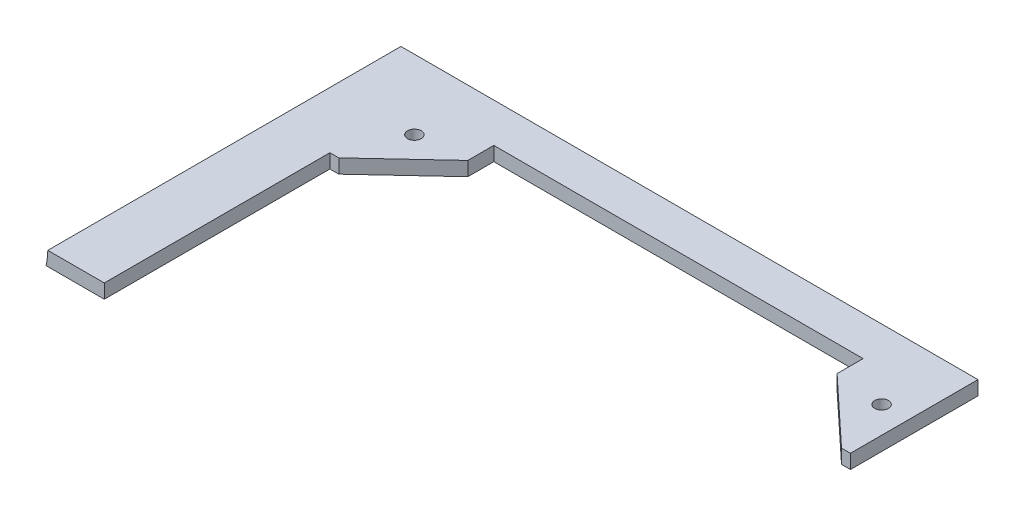
from build123d import *

# Parameters (mm, degrees)
SKETCH1_W            = 152.4
SKETCH1_H            = 76.2
BOSS_EXTRUDE1_DEPTH  = 3.175
SKETCH2_R            = 1.545336663
CUT_EXTRUDE4_DEPTH   = 86.253332046
SKETCH3_W            = 134.7
SKETCH3_H            = 3.175
BOSS_EXTRUDE2_DEPTH  = 3.175
CUT_SWEEP1_PROFILE_R = 12.7


with BuildPart() as part:
    # Sketch1 → Boss-Extrude1 (new body)
    with BuildSketch(Plane(origin=(0, 0, 0), x_dir=(1, 0, 0), z_dir=(0, 1, 0))):
        Rectangle(SKETCH1_W, SKETCH1_H)
    extrude(amount=BOSS_EXTRUDE1_DEPTH)

    # Sketch2 → Cut-Extrude4 (cut, through all)
    with BuildSketch(Plane(origin=(0, 3.175, 0), x_dir=(1, 0, 0), z_dir=(0, 1, 0))):
        Polygon((-58.5, 12.6), (-58.5, -38.1), (76.2, -38.1), (76.2, 38.1), (58.5, 38.1), (58.5, 12.6), (56.5, 12.6), (41.5, 26.6), (41.5, 32.45), (-41.5, 32.45), (-41.5, 26.6), (-56.5, 12.6), align=None)
        with Locations(Location((-52.505245516, 25.605245516, 0), (0, 0, 270))):
            Circle(SKETCH2_R)
        with Locations(Location((52.5, 25.605245516, 0), (0, 0, 270))):
            Circle(SKETCH2_R)
    extrude(amount=-CUT_EXTRUDE4_DEPTH, mode=Mode.SUBTRACT)

    # Sketch3 → Boss-Extrude2 (add)
    with BuildSketch(Plane(origin=(0, 0, -38.1), x_dir=(-1, 0, 0), z_dir=(0, 0, -1))):
        with Locations((8.85, 1.5875)):
            Rectangle(SKETCH3_W, SKETCH3_H)
    extrude(amount=BOSS_EXTRUDE2_DEPTH)

    # Cut-Sweep1: sweep along a curve in space
    with BuildLine() as cut_sweep1_path:
        Line((-83.9, 3.175, 467.883912637), (-83.9, 3.175, -36.654630794))
        Line((-83.9, 3.175, -36.654630794), (-83.9, 3.175, -210.183283037))
    # Cut-Sweep1 profile (on start of the path) → Cut-Sweep1 (sweep, cut)
    with BuildSketch(Plane(origin=(-83.9, 3.175, 467.883912637), x_dir=(-1, 0, 0), z_dir=(0, 0, -1))):
        Circle(CUT_SWEEP1_PROFILE_R)
    sweep(path=cut_sweep1_path.line, mode=Mode.SUBTRACT)


solid = part.part
